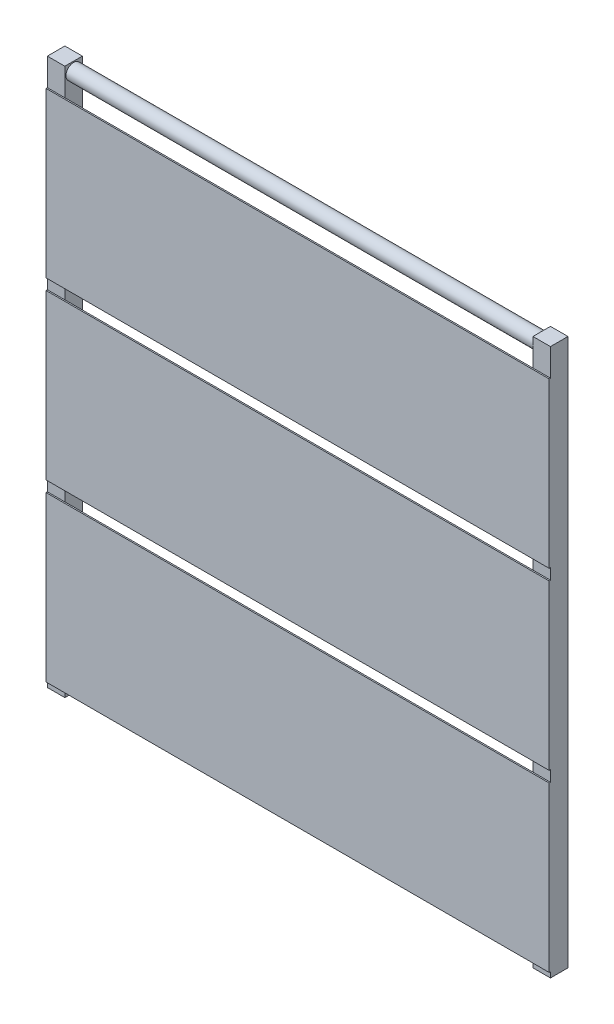
from build123d import *

# Parameters (mm, degrees)
SKETCH1_W             = 16
SKETCH1_H             = 16
BOSS_EXTRUDE1_DEPTH   = 250
BOSS_EXTRUDE1_2_DEPTH = 250
SKETCH2_W             = 460
SKETCH2_H             = 150
BOSS_EXTRUDE2_DEPTH   = 1.2
SKETCH3_R             = 7
BOSS_EXTRUDE3_DEPTH   = 428


with BuildPart() as part:
    # Sketch1 → Boss-Extrude1 (new, symmetric)
    with BuildSketch(Plane(origin=(0, 0, 0), x_dir=(1, 0, 0), z_dir=(0, 1, 0))):
        with Locations((-222, -1.7)):
            Rectangle(SKETCH1_W, SKETCH1_H)
    extrude(amount=BOSS_EXTRUDE1_DEPTH, both=True)



with BuildPart() as body_2:
    # Sketch1 → Boss-Extrude1 2 (new, symmetric)
    with BuildSketch(Plane(origin=(0, 0, 0), x_dir=(1, 0, 0), z_dir=(0, 1, 0))):
        with Locations((222, -1.7)):
            Rectangle(SKETCH1_W, SKETCH1_H)
    extrude(amount=BOSS_EXTRUDE1_2_DEPTH, both=True)


with BuildPart() as part_1:
    add(part.part)

    add(body_2.part)  # Boss-Extrude2 merges body 2
    # Sketch2 → Boss-Extrude2 (add)
    with BuildSketch(Plane.XY.offset(9.7)):
        with Locations((0, 150)):
            Rectangle(SKETCH2_W, SKETCH2_H)
        with Locations((0, -10)):
            Rectangle(SKETCH2_W, SKETCH2_H)
        with Locations((0, -170)):
            Rectangle(SKETCH2_W, SKETCH2_H)
    extrude(amount=BOSS_EXTRUDE2_DEPTH)

    # Sketch3 → Boss-Extrude3 (add)
    with BuildSketch(Plane(origin=(-214, 0, 0), x_dir=(0, 0, -1), z_dir=(1, 0, 0))):
        with Locations(Location((-1.7, 242, 0), (0, 0, 180))):
            Circle(SKETCH3_R)
    extrude(amount=BOSS_EXTRUDE3_DEPTH)


solid = part_1.part
